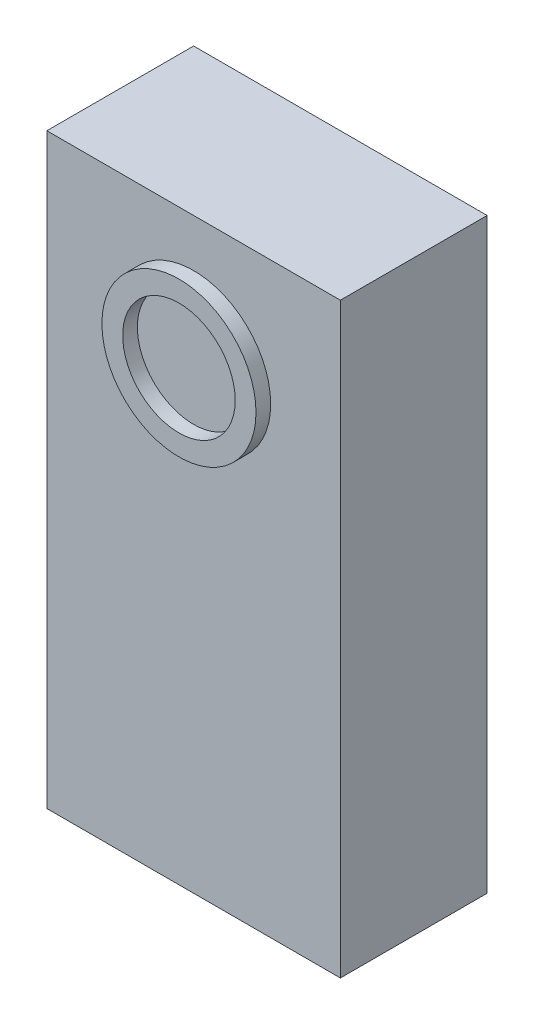
from build123d import *

# Parameters (mm, degrees)
SKETCH1_W           = 2
SKETCH1_H           = 4
BOSS_EXTRUDE1_DEPTH = 1
SKETCH2_R           = 0.525
SKETCH2_R_2         = 0.383355987
BOSS_EXTRUDE2_DEPTH = 0.1


with BuildPart() as part:
    # Sketch1 → Boss-Extrude1 (new body)
    with BuildSketch(Plane.XY):
        Rectangle(SKETCH1_W, SKETCH1_H)
    extrude(amount=BOSS_EXTRUDE1_DEPTH)

    # Sketch2 → Boss-Extrude2 (add)
    with BuildSketch(Plane.XY.offset(1)):
        with Locations((0, 1.15)):
            Circle(SKETCH2_R)
        with Locations((0, 1.15)):
            Circle(SKETCH2_R_2, mode=Mode.SUBTRACT)
    extrude(amount=BOSS_EXTRUDE2_DEPTH)


solid = part.part
